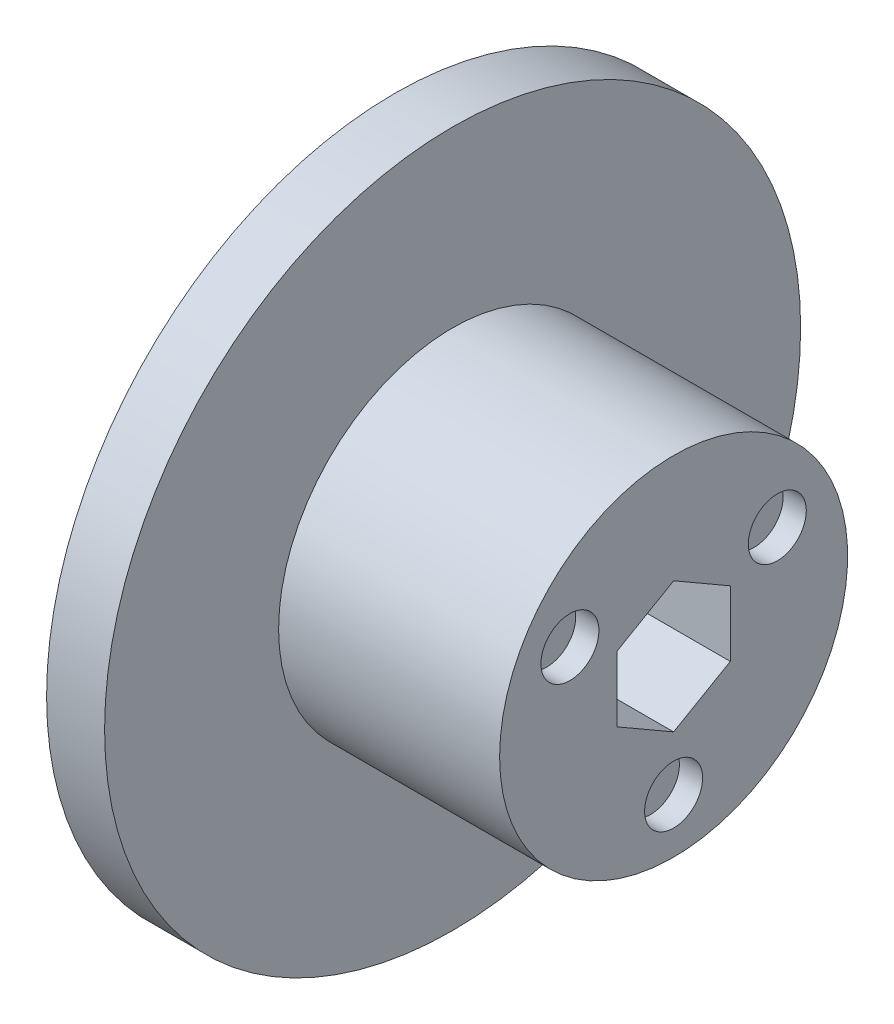
from build123d import *

# Parameters (mm, degrees)
SKETCH2_R           = 30
BOSS_EXTRUDE1_DEPTH = 5
SKETCH3_R           = 15
BOSS_EXTRUDE2_DEPTH = 19.05
CUT_EXTRUDE1_DEPTH  = 24.05
SKETCH5_R           = 2.5
CUT_EXTRUDE2_DEPTH  = 2


with BuildPart() as part:
    # Sketch2 → Boss-Extrude1 (new body)
    with BuildSketch(Plane(origin=(0, 0, 0), x_dir=(0, 0, -1), z_dir=(1, 0, 0))):
        Circle(SKETCH2_R)
    extrude(amount=BOSS_EXTRUDE1_DEPTH)

    # Sketch3 → Boss-Extrude2 (add)
    with BuildSketch(Plane(origin=(5, 0, 0), x_dir=(0, 0, -1), z_dir=(1, 0, 0))):
        with Locations(Location((0, 0, 0), (0, 0, 180))):
            Circle(SKETCH3_R)
    extrude(amount=BOSS_EXTRUDE2_DEPTH)

    # Sketch4 → Cut-Extrude1 (cut)
    with BuildSketch(Plane(origin=(24.05, 0, 0), x_dir=(0, 0, -1), z_dir=(1, 0, 0))):
        Polygon((0, 5.64071213), (-4.885, 2.820356065), (-4.885, -2.820356065), (0, -5.64071213), (4.885, -2.820356065), (4.885, 2.820356065), align=None)
    extrude(amount=-CUT_EXTRUDE1_DEPTH, mode=Mode.SUBTRACT)

    # Sketch5 → Cut-Extrude2 (cut)
    with BuildSketch(Plane(origin=(24.05, 0, 0), x_dir=(0, 0, -1), z_dir=(1, 0, 0))):
        with Locations((8.937690528, 5.160178032)):
            Circle(SKETCH5_R)
        with Locations((-8.937690528, 5.160178032)):
            Circle(SKETCH5_R)
        with Locations((0, -10.320356065)):
            Circle(SKETCH5_R)
    extrude(amount=-CUT_EXTRUDE2_DEPTH, mode=Mode.SUBTRACT)


solid = part.part
